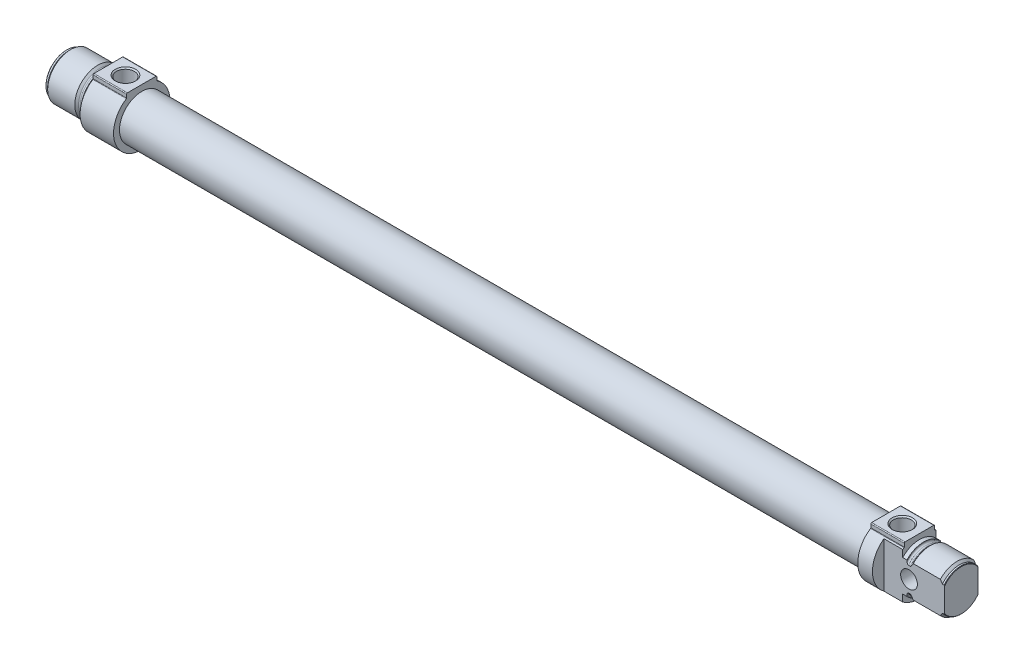
from build123d import *

# Parameters (mm, degrees)
AUFSATZ_LINEAR_AUSTRAGEN1_DEPTH      = 16
SKIZZE3_W                            = 356
SKIZZE3_H                            = 10.65
AUFSATZ_LINEAR_AUSTRAGEN2_DEPTH      = 16
SCHNITT_LINEAR_AUSTRAGEN1_DEPTH      = 13.5
SCHNITT_LINEAR_AUSTRAGEN1_DEPTH_BACK = 13.5
BOHRUNG1_D                           = 8
BOHRUNG2_D                           = 8.566
BOHRUNG2_DEPTH                       = 13.5
BOHRUNG2_CSINK_D                     = 9.728
BOHRUNG2_CSINK_ANGLE                 = 90
BOHRUNG3_D                           = 8.566
BOHRUNG3_DEPTH                       = 16
BOHRUNG3_CSINK_D                     = 9.728
BOHRUNG3_CSINK_ANGLE                 = 90
BOHRUNG3_TIP                         = 2.472791203


with BuildPart() as part:
    # Skizze1 → Rotation1 (revolve)
    with BuildSketch(Plane.XY):
        with BuildLine():
            Line((0, 0), (0, 9.8))
            Line((0, 9.8), (0.2, 10))
            Line((0.2, 10), (1, 10))
            Line((1, 10), (2, 11))
            Line((2, 11), (14.95, 11))
            Line((14.95, 11), (15.865685425, 10.084314575))
            ThreePointArc((15.865685425, 10.084314575), (16.125224104, 9.910896374), (16.43137085, 9.85))
            Line((16.43137085, 9.85), (17.2, 9.85))
            ThreePointArc((17.2, 9.85), (17.765685425, 10.084314575), (18, 10.65))
            Line((18, 10.65), (18, 11))
            Line((18, 11), (20, 11))
            Line((20, 11), (20, 0))
            Line((20, 0), (0, 0))
        make_face()
    revolve(axis=Axis((20, 0, 0), (-1, 0, 0)))

    # Skizze2 → Aufsatz-Linear austragen1 (add)
    with BuildSketch(Plane(origin=(20, 0, 0), x_dir=(0, 0, -1), z_dir=(1, 0, 0))):
        with BuildLine():
            Line((7.25, 11.551515052), (7.25, 13.1))
            ThreePointArc((7.25, 13.1), (7.132842712, 13.382842712), (6.85, 13.5))
            Line((6.85, 13.5), (-6.85, 13.5))
            ThreePointArc((-6.85, 13.5), (-7.132842712, 13.382842712), (-7.25, 13.1))
            Line((-7.25, 13.1), (-7.25, 11.551515052))
            ThreePointArc((-7.25, 11.551515052), (-7.286144803, 11.408754992), (-7.385869565, 11.30039516))
            ThreePointArc((-7.385869565, 11.30039516), (0, -13.5), (7.385869565, 11.30039516))
            ThreePointArc((7.385869565, 11.30039516), (7.286144803, 11.408754992), (7.25, 11.551515052))
        make_face()
    extrude(amount=AUFSATZ_LINEAR_AUSTRAGEN1_DEPTH)

    # Skizze3 → Rotation2 (revolve)
    with BuildSketch(Plane.XY):
        with Locations((214, 5.325)):
            Rectangle(SKIZZE3_W, SKIZZE3_H)
    revolve(axis=Axis((392, 0, 0), (-1, 0, 0)))

    # Skizze4 → Aufsatz-Linear austragen2 (add)
    with BuildSketch(Plane(origin=(392, 0, 0), x_dir=(0, 0, -1), z_dir=(1, 0, 0))):
        with BuildLine():
            Line((7.25, 11.551515052), (7.25, 13.1))
            ThreePointArc((7.25, 13.1), (7.132842712, 13.382842712), (6.85, 13.5))
            Line((6.85, 13.5), (-6.85, 13.5))
            ThreePointArc((-6.85, 13.5), (-7.132842712, 13.382842712), (-7.25, 13.1))
            Line((-7.25, 13.1), (-7.25, 11.551515052))
            ThreePointArc((-7.25, 11.551515052), (-7.286144803, 11.408754992), (-7.385869565, 11.30039516))
            ThreePointArc((-7.385869565, 11.30039516), (0, -13.5), (7.385869565, 11.30039516))
            ThreePointArc((7.385869565, 11.30039516), (7.286144803, 11.408754992), (7.25, 11.551515052))
        make_face()
    extrude(amount=AUFSATZ_LINEAR_AUSTRAGEN2_DEPTH)

    # Skizze5 → Rotation3 (revolve)
    with BuildSketch(Plane.XY):
        with BuildLine():
            Line((408, 0), (408, 11))
            Line((408, 11), (410, 11))
            Line((410, 11), (410, 10.65))
            ThreePointArc((410, 10.65), (410.234314575, 10.084314575), (410.8, 9.85))
            Line((410.8, 9.85), (411.56862915, 9.85))
            ThreePointArc((411.56862915, 9.85), (411.874775896, 9.910896374), (412.134314575, 10.084314575))
            Line((412.134314575, 10.084314575), (413.05, 11))
            Line((413.05, 11), (426, 11))
            Line((426, 11), (427, 10))
            Line((427, 10), (427.8, 10))
            Line((427.8, 10), (428, 9.8))
            Line((428, 9.8), (428, 0))
            Line((428, 0), (408, 0))
        make_face()
    revolve(axis=Axis((428, 0, 0), (-1, 0, 0)))

    # Skizze6 → Schnitt-Linear austragen1 (cut, two sides: drawn at the far end of the back side and taken through both)
    with BuildSketch(Plane(origin=(0, 0, 0), x_dir=(1, 0, 0), z_dir=(0, 1, 0)).offset(-SCHNITT_LINEAR_AUSTRAGEN1_DEPTH_BACK)):
        Polygon((399, 24), (399, 8), (428, 8), (428, -8), (399, -8), (399, -24), (444, -24), (444, 24), align=None)
    extrude(amount=SCHNITT_LINEAR_AUSTRAGEN1_DEPTH + SCHNITT_LINEAR_AUSTRAGEN1_DEPTH_BACK, mode=Mode.SUBTRACT)

    # Bohrung1 (through all)
    with Locations(Plane(origin=(0, 0, -8), x_dir=(-1, 0, 0), z_dir=(0, 0, -1))):
        with Locations((-411, 0)):
            Hole(BOHRUNG1_D / 2)

    # Bohrung2
    with Locations(Plane(origin=(0, 13.5, 0), x_dir=(1, 0, 0), z_dir=(0, 1, 0))):
        with Locations((28.2, 0)):
            CounterSinkHole(BOHRUNG2_D / 2, BOHRUNG2_CSINK_D / 2, depth=BOHRUNG2_DEPTH, counter_sink_angle=BOHRUNG2_CSINK_ANGLE)

    # Bohrung3
    with Locations(Plane(origin=(0, 13.5, 0), x_dir=(1, 0, 0), z_dir=(0, 1, 0))):
        with Locations((399.8, 0)):
            CounterSinkHole(BOHRUNG3_D / 2, BOHRUNG3_CSINK_D / 2, depth=BOHRUNG3_DEPTH, counter_sink_angle=BOHRUNG3_CSINK_ANGLE)
            with Locations((0, 0, -(BOHRUNG3_DEPTH + BOHRUNG3_TIP / 2))):  # 120° drill point
                Cone(0, BOHRUNG3_D / 2, BOHRUNG3_TIP, mode=Mode.SUBTRACT)

    # Skizze13 → Schnitt-Rotation1 (revolve, cut)
    with BuildSketch(Plane.XY):
        Polygon((-4, 0), (-4, 4), (50.3, 4), (50.3, 10), (375.3, 10), (375.3, 0), align=None)
    revolve(axis=Axis((375.3, 0, 0), (-1, 0, 0)), mode=Mode.SUBTRACT)


solid = part.part
